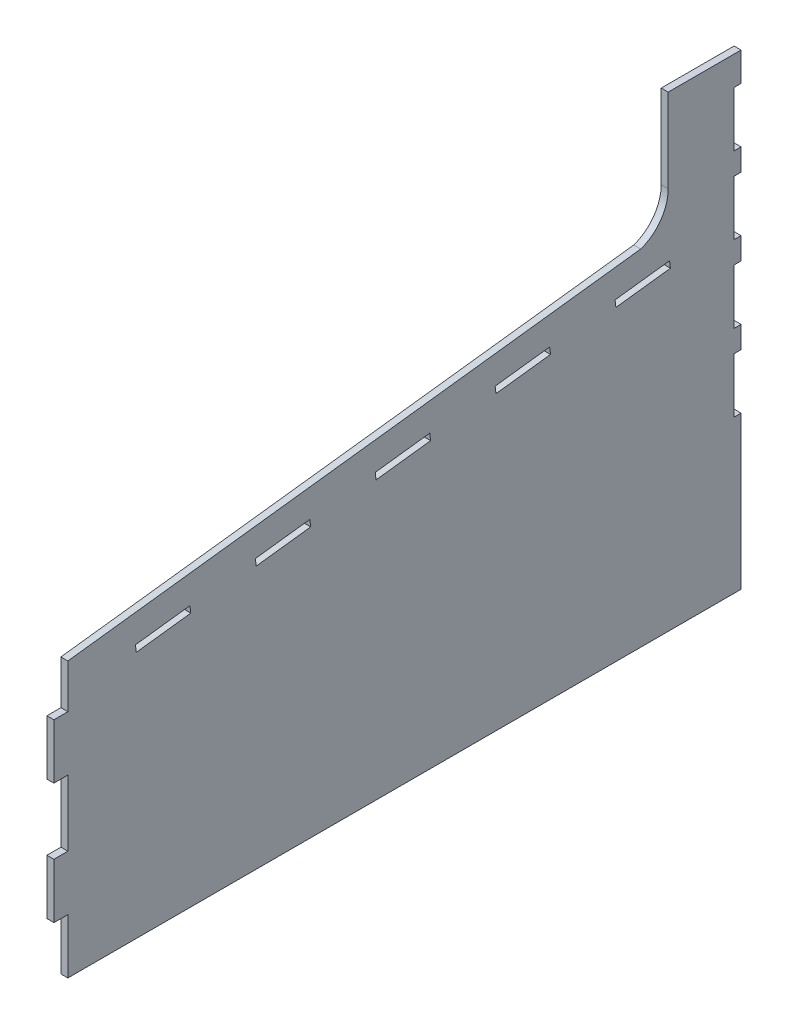
from build123d import *

# Parameters (mm, degrees)
BOSS_EXTRUDE1_DEPTH = 6.35
CUT_EXTRUDE1_DEPTH  = 6.35


with BuildPart() as part:
    # Sketch1 → Boss-Extrude1 (new body)
    with BuildSketch(Plane(origin=(0, 0, 0), x_dir=(0, 0, -1), z_dir=(1, 0, 0))):
        with BuildLine():
            Line((0, 250), (521.678128656, 314.05401996))
            ThreePointArc((521.678128656, 314.05401996), (539.766779046, 327.550652044), (546.65, 349.044363214))
            Line((546.65, 349.044363214), (546.65, 425.274363214))
            Line((546.65, 425.274363214), (613, 425.274363214))
            Line((613, 425.274363214), (613, 398.924363214))
            Line((613, 398.924363214), (606.65, 398.924363214))
            Line((606.65, 398.924363214), (606.65, 348.924363214))
            Line((606.65, 348.924363214), (613, 348.924363214))
            Line((613, 348.924363214), (613, 328.939575476))
            Line((613, 328.939575476), (606.65, 328.939575476))
            Line((606.65, 328.939575476), (606.65, 278.939575476))
            Line((606.65, 278.939575476), (613, 278.939575476))
            Line((613, 278.939575476), (613, 258.954787738))
            Line((613, 258.954787738), (606.65, 258.954787738))
            Line((606.65, 258.954787738), (606.65, 208.954787738))
            Line((606.65, 208.954787738), (613, 208.954787738))
            Line((613, 208.954787738), (613, 188.97))
            Line((613, 188.97), (606.65, 188.97))
            Line((606.65, 188.97), (606.65, 138.97))
            Line((606.65, 138.97), (613, 138.97))
            Line((613, 138.97), (613, 0))
            Line((613, 0), (0, 0))
            Line((0, 0), (0, 50))
            Line((0, 50), (-12.7, 50))
            Line((-12.7, 50), (-12.7, 100))
            Line((-12.7, 100), (0, 100))
            Line((0, 100), (0, 160))
            Line((0, 160), (-12.7, 160))
            Line((-12.7, 160), (-12.7, 210))
            Line((-12.7, 210), (0, 210))
            Line((0, 210), (0, 250))
        make_face()
    extrude(amount=BOSS_EXTRUDE1_DEPTH)

    # Sketch2 → Cut-Extrude1 (cut)
    with BuildSketch(Plane(origin=(6.35, 0, 0), x_dir=(0, 0, -1), z_dir=(1, 0, 0))):
        Polygon((61.537861402, 231.965149724), (62.311731732, 225.662481662), (111.939039314, 231.755948832), (111.165168984, 238.058616895), align=None)
        Polygon((220.345245664, 251.464244669), (170.717938082, 245.370777499), (171.491808413, 239.068109436), (221.119115995, 245.161576606), align=None)
        Polygon((329.525322345, 264.869872444), (279.898014763, 258.776405274), (280.671885093, 252.473737211), (330.299192676, 258.567204381), align=None)
        Polygon((438.705399025, 278.275500218), (389.078091443, 272.182033048), (389.851961774, 265.879364985), (439.479269356, 271.972832155), align=None)
        Polygon((547.885475706, 291.681127993), (498.258168124, 285.587660823), (499.032038455, 279.28499276), (548.659346037, 285.37845993), align=None)
    extrude(amount=-CUT_EXTRUDE1_DEPTH, mode=Mode.SUBTRACT)


solid = part.part
